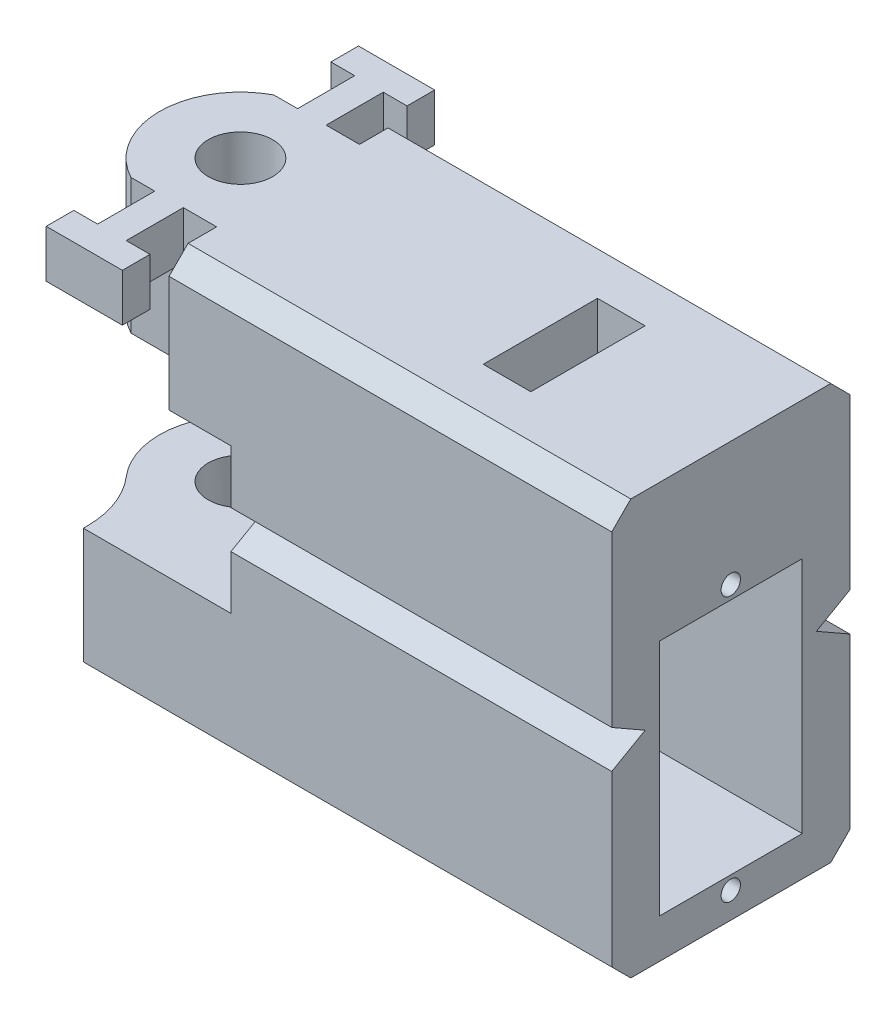
from build123d import *

# Parameters (mm, degrees)
BOSS_EXTRUDE1_DEPTH = 55.5
CHAMFER1_SIZE       = 2
SKETCH4_W           = 8
SKETCH4_H           = 32.8
BOSS_EXTRUDE2_DEPTH = 5
SKETCH7_W           = 3.5
SKETCH7_H           = 6
CUT_EXTRUDE5_DEPTH  = 10
SKETCH5_R           = 3.375
CUT_EXTRUDE3_DEPTH  = 77.250596562
SKETCH6_R           = 3.375
CUT_EXTRUDE4_DEPTH  = 7.62
SKETCH8_W           = 9
SKETCH8_H           = 5
CUT_EXTRUDE6_DEPTH  = 9.167
BOSS_EXTRUDE3_DEPTH = 14.167
BOSS_EXTRUDE4_START = -29.407
BOSS_EXTRUDE4_DEPTH = 14.167
FILLET1_R           = 10
SKETCH10_W          = 15
SKETCH10_H          = 25
CUT_EXTRUDE7_DEPTH  = 20
SKETCH11_R          = 1.016
CUT_EXTRUDE8_DEPTH  = 8
SKETCH12_W          = 5
SKETCH12_H          = 12
CUT_EXTRUDE9_DEPTH  = 14.437


with BuildPart() as part:
    # Sketch1 → Boss-Extrude1 (new body)
    with BuildSketch(Plane(origin=(0, 0, 0), x_dir=(0, 0, -1), z_dir=(1, 0, 0))):
        Polygon((0, 0), (25, 0), (25, 19.787), (21.5, 21.787), (25, 23.787), (25, 43.574), (0, 43.574), (0, 23.787), (3.5, 21.787), (0, 19.787), align=None)
    extrude(amount=BOSS_EXTRUDE1_DEPTH)

    # Chamfer1
    chamfer1_edges = [part.edges().sort_by_distance(p)[0] for p in [
        (27.75, 43.574, 0),
        (27.75, 43.574, -25),
        (27.75, 0, -25),
        (27.75, 0, 0),
    ]]
    chamfer(chamfer1_edges, length=CHAMFER1_SIZE)

    # Sketch4 → Boss-Extrude2 (add)
    with BuildSketch(Plane(origin=(0, 43.574, 0), x_dir=(1, 0, 0), z_dir=(0, 1, 0))):
        with Locations((4, 12.5)):
            Rectangle(SKETCH4_W, SKETCH4_H)
    extrude(amount=-BOSS_EXTRUDE2_DEPTH)

    # Sketch7 → Cut-Extrude5 (cut)
    with BuildSketch(Plane(origin=(0, 43.574, 0), x_dir=(1, 0, 0), z_dir=(0, 1, 0))):
        with Locations((7.25, 2)):
            Rectangle(SKETCH7_W, SKETCH7_H)
        with Locations((7.25, 23)):
            Rectangle(SKETCH7_W, SKETCH7_H)
        with Locations((0.75, 2)):
            Rectangle(SKETCH7_W, SKETCH7_H)
        with Locations((0.75, 23)):
            Rectangle(SKETCH7_W, SKETCH7_H)
    extrude(amount=-CUT_EXTRUDE5_DEPTH, mode=Mode.SUBTRACT)

    # Sketch5 → Cut-Extrude3 (cut, through all)
    with BuildSketch(Plane(origin=(0, 43.574, 0), x_dir=(1, 0, 0), z_dir=(0, 1, 0))):
        with Locations(Location((4, 12.5, 0), (0, 0, 270))):
            Circle(SKETCH5_R)
    extrude(amount=-CUT_EXTRUDE3_DEPTH, mode=Mode.SUBTRACT)

    # Sketch6 → Cut-Extrude4 (cut, symmetric)
    with BuildSketch(Plane(origin=(0, 21.787, 0), x_dir=(-1, 0, 0), z_dir=(0, -1, 0))):
        Polygon((-4, 30), (4.5, 30), (4.5, -5), (-4, -5), (-15.5, -5), (-15.5, 30), align=None)
        with Locations(Location((-4, 12.5, 0), (0, 0, 270))):
            Circle(SKETCH6_R, mode=Mode.SUBTRACT)
    extrude(amount=CUT_EXTRUDE4_DEPTH, both=True, mode=Mode.SUBTRACT)

    # Sketch8 → Cut-Extrude6 (cut)
    with BuildSketch(Plane.XZ.offset(-29.407)):
        with Locations((4.5, -22.5)):
            Rectangle(SKETCH8_W, SKETCH8_H)
        with Locations((4.5, -2.5)):
            Rectangle(SKETCH8_W, SKETCH8_H)
    extrude(amount=-CUT_EXTRUDE6_DEPTH, mode=Mode.SUBTRACT)

    # Sketch9 → Boss-Extrude3 (add)
    with BuildSketch(Plane(origin=(0, 43.574, 0), x_dir=(1, 0, 0), z_dir=(0, 1, 0))):
        with BuildLine():
            Line((0, 20), (0, 5))
            ThreePointArc((0, 5), (-4.5, 12.5), (0, 20))
        make_face()
    extrude(amount=-BOSS_EXTRUDE3_DEPTH)

    # Sketch9<2> → Boss-Extrude4 (add)
    with BuildSketch(Plane(origin=(0, 43.574, 0), x_dir=(1, 0, 0), z_dir=(0, 1, 0)).offset(BOSS_EXTRUDE4_START)):
        with BuildLine():
            Line((0, 20), (0, 5))
            ThreePointArc((0, 5), (-4.5, 12.5), (0, 20))
        make_face()
    extrude(amount=-BOSS_EXTRUDE4_DEPTH)

    # Fillet1
    fillet1_edges = [part.edges().sort_by_distance(p)[0] for p in [
        (0, 7.0835, -20),
        (0, 7.0835, -5),
    ]]
    fillet(fillet1_edges, radius=FILLET1_R)

    # Sketch10 → Cut-Extrude7 (cut)
    with BuildSketch(Plane(origin=(55.5, 0, 0), x_dir=(0, 0, -1), z_dir=(1, 0, 0))):
        with Locations((12.5, 16.637)):
            Rectangle(SKETCH10_W, SKETCH10_H)
    extrude(amount=-CUT_EXTRUDE7_DEPTH, mode=Mode.SUBTRACT)

    # Sketch11 → Cut-Extrude8 (cut)
    with BuildSketch(Plane(origin=(55.5, 0, 0), x_dir=(0, 0, -1), z_dir=(1, 0, 0))):
        with Locations((12.5, 30.537)):
            Circle(SKETCH11_R)
        with Locations(Location((12.5, 2.737, 0), (0, 0, 180))):
            Circle(SKETCH11_R)
    extrude(amount=-CUT_EXTRUDE8_DEPTH, mode=Mode.SUBTRACT)

    # Sketch12 → Cut-Extrude9 (cut)
    with BuildSketch(Plane(origin=(0, 43.574, 0), x_dir=(1, 0, 0), z_dir=(0, 1, 0))):
        with Locations((38, 12.5)):
            Rectangle(SKETCH12_W, SKETCH12_H)
    extrude(amount=-CUT_EXTRUDE9_DEPTH, mode=Mode.SUBTRACT)


solid = part.part
